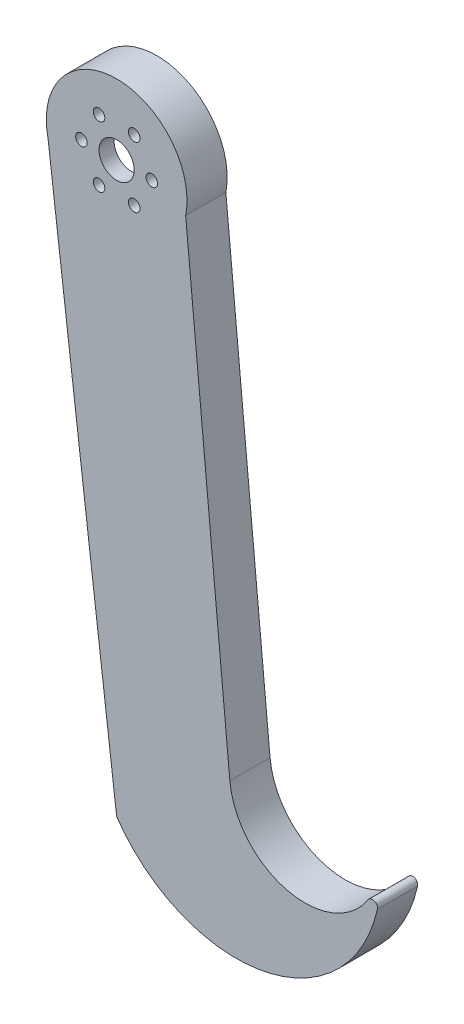
from build123d import *

# Parameters (mm, degrees)
SKETCH_1_R          = 14
EXTRUDE_1_DEPTH     = 8
SKETCH_3_R          = 3.5
CUT_EXTRUDE_2_DEPTH = 10
EXTRUDE_START       = -8
EXTRUDE_3_DEPTH     = 8
SKETCH_2_R          = 10.6
CUT_EXTRUDE_3_DEPTH = 5
SKETCH_7_R          = 1.15
CUT_EXTRUDE_4_DEPTH = 5
FILLET_1_R          = 1
FILLET_2_R          = 1


with BuildPart() as part:
    # 스케치1 → 보스-돌출1 (new body)
    with BuildSketch(Plane.XY):
        Circle(SKETCH_1_R)
    extrude(amount=EXTRUDE_1_DEPTH)

    # 스케치3 → 컷-돌출2 (cut)
    with BuildSketch(Plane.XY.offset(8)):
        Circle(SKETCH_3_R)
    extrude(amount=-CUT_EXTRUDE_2_DEPTH, mode=Mode.SUBTRACT)

    # 스케치6 → 보스-돌출3 (add)
    with BuildSketch(Plane.XY.offset(8).offset(EXTRUDE_START)):
        with BuildLine():
            Line((13.735578357, -2.708115061), (22.528484651, -95.708115061))
            ThreePointArc((22.528484651, -95.708115061), (38.172657843, -109.27935171), (52.461884597, -94.288133687))
            ThreePointArc((52.461884597, -94.288133687), (33.515079478, -123.998980013), (0, -113.115264599))
            Line((0, -113.115264599), (-13.64899727, -3.115264599))
            ThreePointArc((-13.64899727, -3.115264599), (0.208126783, -13.998452887), (13.735578357, -2.708115061))
        make_face()
    extrude(amount=EXTRUDE_3_DEPTH)

    # 스케치2 → 컷-돌출3 (cut)
    with BuildSketch(Plane(origin=(0, 0, 0), x_dir=(-1, 0, 0), z_dir=(0, 0, -1))):
        Circle(SKETCH_2_R)
    extrude(amount=-CUT_EXTRUDE_3_DEPTH, mode=Mode.SUBTRACT)

    # 스케치7 → 컷-돌출4 (cut)
    with BuildSketch(Plane(origin=(0, 0, 5), x_dir=(-1, 0, 0), z_dir=(0, 0, -1))):
        with Locations((7, 0)):
            Circle(SKETCH_7_R)
        with Locations((3.5, -6.062177826)):
            Circle(SKETCH_7_R)
        with Locations((-3.5, -6.062177826)):
            Circle(SKETCH_7_R)
        with Locations((-7, 0)):
            Circle(SKETCH_7_R)
        with Locations((-3.5, 6.062177826)):
            Circle(SKETCH_7_R)
        with Locations((3.5, 6.062177826)):
            Circle(SKETCH_7_R)
    extrude(amount=-CUT_EXTRUDE_4_DEPTH, mode=Mode.SUBTRACT)

    # 필렛1
    fillet_1_edges = [part.edges().sort_by_distance(p)[0] for p in [
        (52.461884597, -94.288133687, 4),
    ]]
    fillet(fillet_1_edges, radius=FILLET_1_R)

    # 필렛2
    fillet_2_edges = [part.edges().sort_by_distance(p)[0] for p in [
        (0, -113.115264599, 4),
    ]]
    fillet(fillet_2_edges, radius=FILLET_2_R)


solid = part.part
